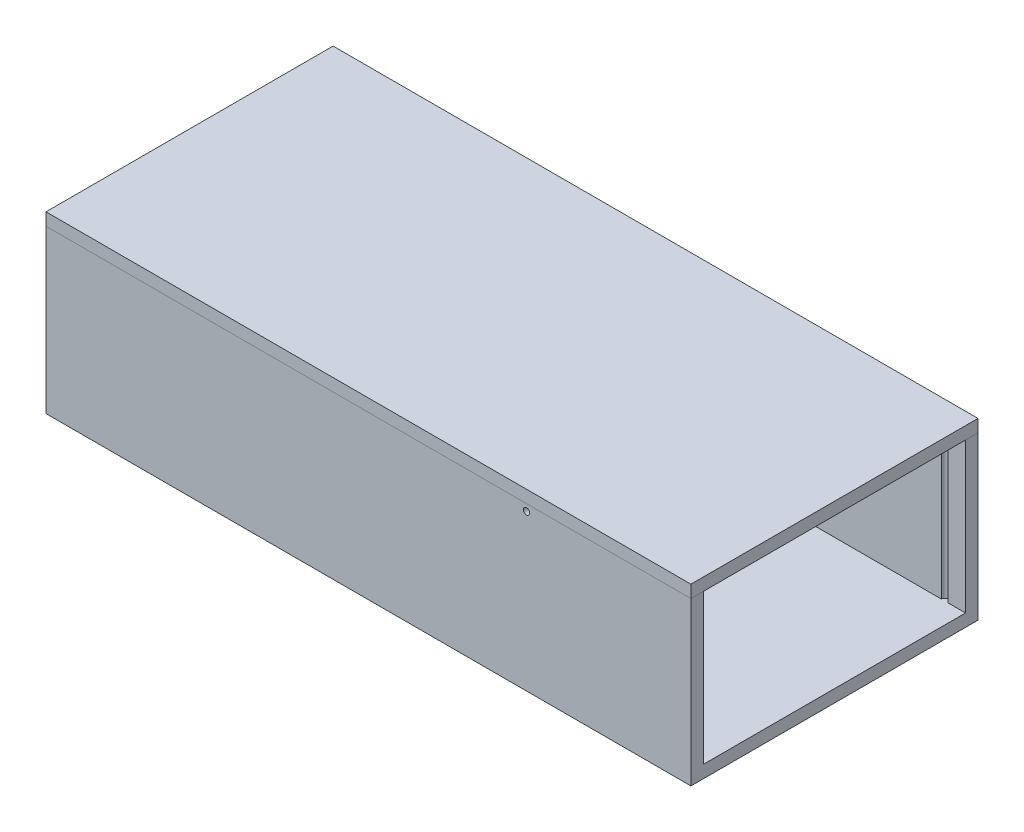
from build123d import *

# Parameters (mm, degrees)
ESBO_O1_W                = 155
ESBO_O1_H                = 69
RESSALTO_EXTRUS_O1_DEPTH = 39
ESBO_O2_W                = 153
ESBO_O2_H                = 63
CORTE_EXTRUS_O1_DEPTH    = 36
RESSALTO_EXTRUS_O3_START = -4.1
ESBO_O5_W                = 120.5
ESBO_O5_H                = 2
RESSALTO_EXTRUS_O3_DEPTH = 5.4
ESBO_O7_R                = 0.8
CORTE_EXTRUS_O4_DEPTH    = 36
ESBO_O10_R               = 0.75
RESSALTO_EXTRUS_O5_DEPTH = 4.1
ESBO_O9_W                = 155
ESBO_O9_H                = 69
RESSALTO_EXTRUS_O4_DEPTH = 3
ESBO_O11_W               = 18.1
ESBO_O11_H               = 15.1
RESSALTO_EXTRUS_O6_DEPTH = 5
ESBO_O12_W               = 15
ESBO_O12_H               = 11.5
CORTE_EXTRUS_O5_DEPTH    = 9
ESBO_O14_W               = 13.5
ESBO_O14_H               = 1.85
CORTE_EXTRUS_O6_DEPTH    = 180.234483289
ESBO_O15_R               = 0.75
CORTE_EXTRUS_O7_DEPTH    = 175.785582929


with BuildPart() as part:
    # Esboço1 → Ressalto-extrusão1 (new body)
    with BuildSketch(Plane(origin=(0, 0, 0), x_dir=(1, 0, 0), z_dir=(0, 1, 0))):
        with Locations((77.5, 34.5)):
            Rectangle(ESBO_O1_W, ESBO_O1_H)
    extrude(amount=RESSALTO_EXTRUS_O1_DEPTH)

    # Esboço2 → Corte-extrusão1 (cut)
    with BuildSketch(Plane(origin=(0, 39, 0), x_dir=(1, 0, 0), z_dir=(0, 1, 0))):
        with Locations((78.5, 34.5)):
            Rectangle(ESBO_O2_W, ESBO_O2_H)
    extrude(amount=-CORTE_EXTRUS_O1_DEPTH, mode=Mode.SUBTRACT)

    # Esboço5 → Ressalto-extrusão3 (add)
    with BuildSketch(Plane(origin=(0, 39, 0), x_dir=(1, 0, 0), z_dir=(0, 1, 0)).offset(RESSALTO_EXTRUS_O3_START)):
        with Locations((62.25, 4)):
            Rectangle(ESBO_O5_W, ESBO_O5_H)
        with Locations((62.25, 65)):
            Rectangle(ESBO_O5_W, ESBO_O5_H)
    extrude(amount=-RESSALTO_EXTRUS_O3_DEPTH)

    # Esboço7 → Corte-extrusão4 (cut)
    with BuildSketch(Plane(origin=(0, 39, 0), x_dir=(1, 0, 0), z_dir=(0, 1, 0))):
        with Locations((150, 3)):
            Circle(ESBO_O7_R)
        with Locations((150, 66)):
            Circle(ESBO_O7_R)
    extrude(amount=-CORTE_EXTRUS_O4_DEPTH, mode=Mode.SUBTRACT)

    # Esboço10 → Ressalto-extrusão5 (add)
    with BuildSketch(Plane(origin=(0, 39, 0), x_dir=(1, 0, 0), z_dir=(0, 1, 0))):
        with Locations((7, 3)):
            Circle(ESBO_O10_R)
        with Locations((7, 66)):
            Circle(ESBO_O10_R)
    extrude(amount=-RESSALTO_EXTRUS_O5_DEPTH)

    # Esboço11 → Ressalto-extrusão6 (add)
    with BuildSketch(Plane.ZY):
        with Locations((-53.3, 29.45)):
            Rectangle(ESBO_O11_W, ESBO_O11_H)
    extrude(amount=RESSALTO_EXTRUS_O6_DEPTH)

    # Esboço12 → Corte-extrusão5 (cut)
    with BuildSketch(Plane.ZY.offset(5)):
        with Locations((-53.3, 29.5)):
            Rectangle(ESBO_O12_W, ESBO_O12_H)
    extrude(amount=-CORTE_EXTRUS_O5_DEPTH, mode=Mode.SUBTRACT)

    # Esboço14 → Corte-extrusão6 (cut, through all)
    with BuildSketch(Plane.ZY.offset(5)):
        with Locations((-53.3, 22.825)):
            Rectangle(ESBO_O14_W, ESBO_O14_H)
    extrude(amount=-CORTE_EXTRUS_O6_DEPTH, mode=Mode.SUBTRACT)

    # Esboço15 → Corte-extrusão7 (cut, through all)
    with BuildSketch(Plane(origin=(0, 0, -69), x_dir=(-1, 0, 0), z_dir=(0, 0, -1))):
        with Locations((-115.5, 37.4)):
            Circle(ESBO_O15_R)
    extrude(amount=-CORTE_EXTRUS_O7_DEPTH, mode=Mode.SUBTRACT)


with BuildPart() as body_2:
    # Esboço9 → Ressalto-extrusão4 (new body)
    with BuildSketch(Plane(origin=(0, 39, 0), x_dir=(1, 0, 0), z_dir=(0, 1, 0))):
        with Locations((77.5, 34.5)):
            Rectangle(ESBO_O9_W, ESBO_O9_H)
    extrude(amount=RESSALTO_EXTRUS_O4_DEPTH)


solid = Compound([part.part, body_2.part])
